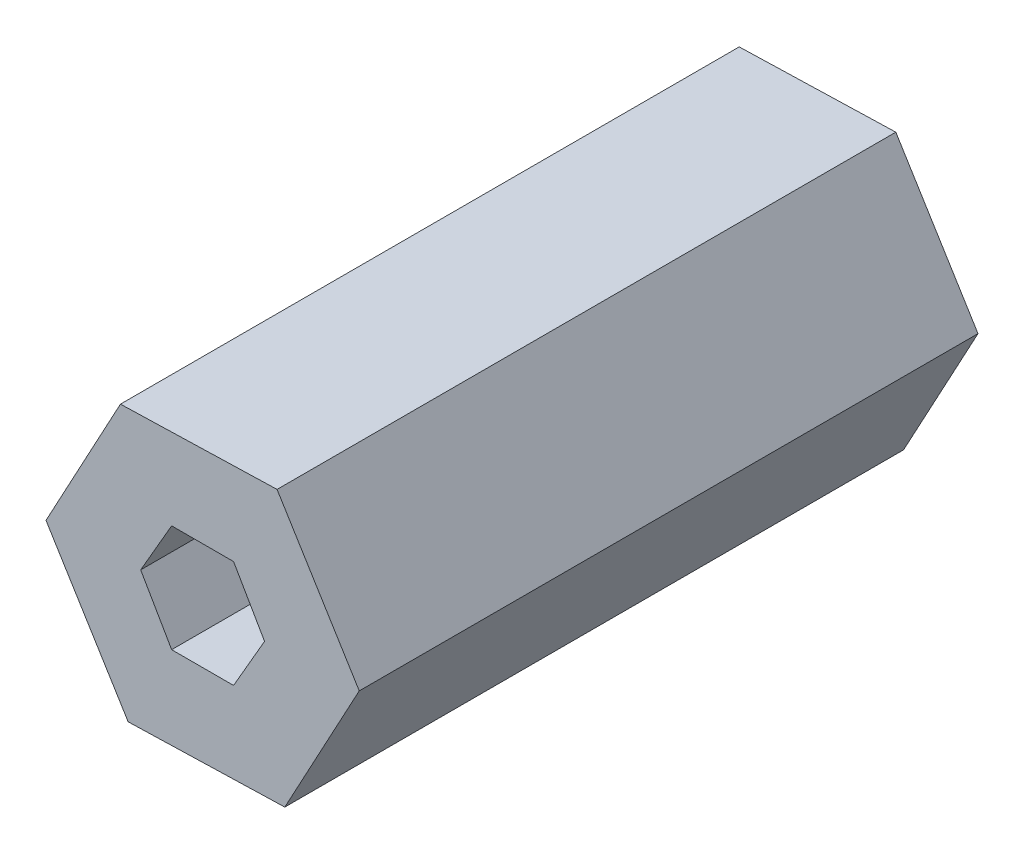
from build123d import *

# Parameters (mm, degrees)
BOSS_EXTRUDE2_DEPTH = 28.956


with BuildPart() as part:
    # Sketch4 → Boss-Extrude2 (new body)
    # profile 1 of 2: a face of its own
    with BuildSketch(Plane.XY):
        Polygon((-3.483559495, -6.4519878), (3.845805592, -6.242844919), (7.329365088, 0.209142882), (3.483559495, 6.4519878), (-3.845805592, 6.242844919), (-7.329365088, -0.209142882), align=None)
        Polygon((2.306514325, -3.995), (4.613028651, 0), (2.306514325, 3.995), (-2.306514325, 3.995), (-4.613028651, 0), (-2.306514325, -3.995), align=None, mode=Mode.SUBTRACT)
    # profile 2 of 2: a face of its own
    with BuildSketch(Plane.XY):
        Polygon((-2.306514325, -3.995), (2.306514325, -3.995), (4.613028651, 0), (2.306514325, 3.995), (-2.306514325, 3.995), (-4.613028651, 0), align=None)
        Polygon((1.449149176, -2.51), (2.898298351, 0), (1.449149176, 2.51), (-1.449149176, 2.51), (-2.898298351, 0), (-1.449149176, -2.51), align=None, mode=Mode.SUBTRACT)
    extrude(amount=BOSS_EXTRUDE2_DEPTH)


solid = part.part
